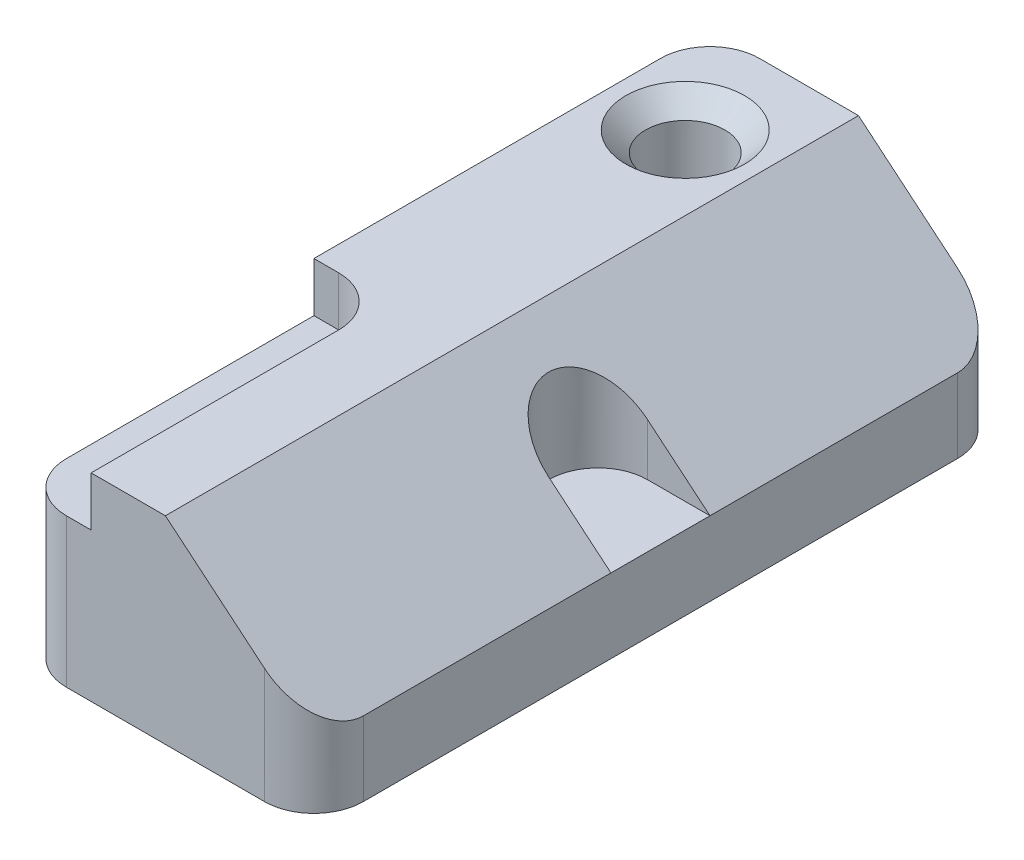
from build123d import *

# Parameters (mm, degrees)
BOSS_EXTRUDE1_DEPTH = 177.8
SKETCH5_R           = 10.16
CUT_EXTRUDE1_DEPTH  = 200.9998
CHAMFER1_SIZE       = 5.08
SKETCH6_W           = 19.05
SKETCH6_H           = 76.2
CUT_EXTRUDE2_DEPTH  = 12.7
FILLET1_R           = 12.7
CUT_EXTRUDE3_DEPTH  = 31.75
FILLET2_R           = 12.7


with BuildPart() as part:
    # Sketch1 → Boss-Extrude1 (new body)
    with BuildSketch(Plane.XY):
        Polygon((0, 0), (0, 50.8), (38.1, 50.8), (76.2, 19.05), (76.2, 0), align=None)
    extrude(amount=BOSS_EXTRUDE1_DEPTH)

    # Sketch5 → Cut-Extrude1 (cut, through all)
    with BuildSketch(Plane(origin=(0, 50.8, 0), x_dir=(1, 0, 0), z_dir=(0, 1, 0))):
        with Locations(Location((19.05, -25.4, 0), (0, 0, 270))):
            Circle(SKETCH5_R)
    extrude(amount=-CUT_EXTRUDE1_DEPTH, mode=Mode.SUBTRACT)

    # Chamfer1
    chamfer1_edges = [part.edges().sort_by_distance(p)[0] for p in [
        (19.05, 50.8, 15.24),
    ]]
    chamfer(chamfer1_edges, length=CHAMFER1_SIZE)

    # Sketch6 → Cut-Extrude2 (cut)
    with BuildSketch(Plane(origin=(0, 50.8, 0), x_dir=(1, 0, 0), z_dir=(0, 1, 0))):
        with Locations((9.525, -139.7)):
            Rectangle(SKETCH6_W, SKETCH6_H)
    extrude(amount=-CUT_EXTRUDE2_DEPTH, mode=Mode.SUBTRACT)

    # Fillet1
    fillet1_edges = [part.edges().sort_by_distance(p)[0] for p in [
        (19.05, 44.45, 101.6),
    ]]
    fillet(fillet1_edges, radius=FILLET1_R)

    # Sketch7 → Cut-Extrude3 (cut)
    with BuildSketch(Plane(origin=(0, 50.8, 0), x_dir=(1, 0, 0), z_dir=(0, 1, 0))):
        with BuildLine():
            Line((76.2, -76.2), (60.198, -76.2))
            ThreePointArc((60.198, -76.2), (47.498, -88.9), (60.198, -101.6))
            Line((60.198, -101.6), (76.2, -101.6))
            Line((76.2, -101.6), (76.2, -76.2))
        make_face()
    extrude(amount=-CUT_EXTRUDE3_DEPTH, mode=Mode.SUBTRACT)

    # Fillet2
    fillet2_edges = [part.edges().sort_by_distance(p)[0] for p in [
        (0, 19.05, 177.8),
        (0, 25.4, 0),
        (76.2, 9.525, 0),
        (76.2, 9.525, 177.8),
    ]]
    fillet(fillet2_edges, radius=FILLET2_R)


solid = part.part
